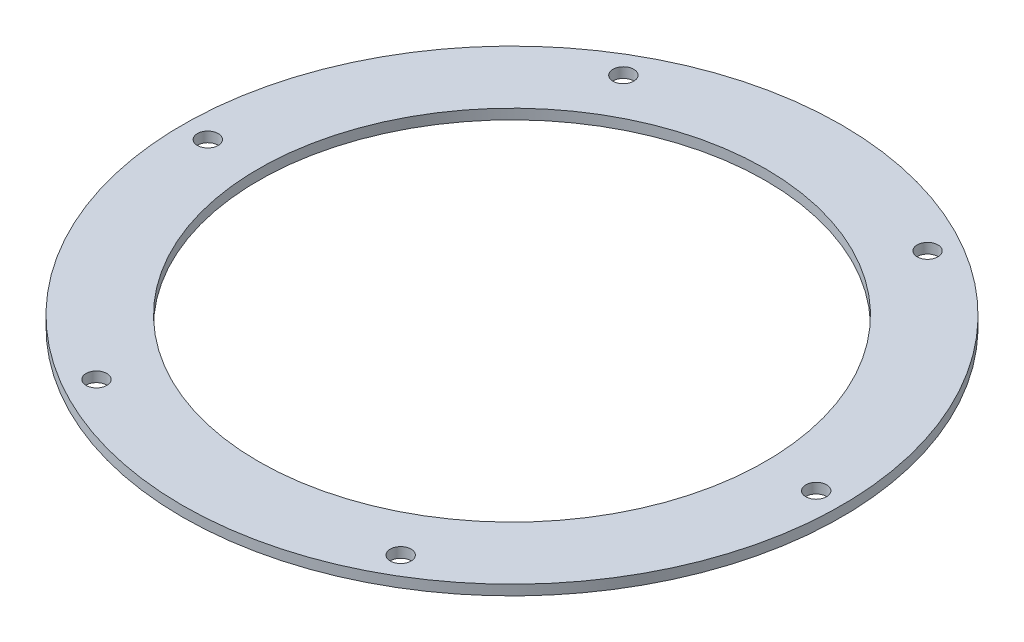
from build123d import *

# Parameters (mm, degrees)
SKETCH_1_R      = 65
SKETCH_1_R_2    = 50
SKETCH_1_R_3    = 2.05
EXTRUDE_1_DEPTH = 2


with BuildPart() as part:
    # 草图1 → 凸台-拉伸1 (new body)
    with BuildSketch(Plane(origin=(0, 0, 0), x_dir=(1, 0, 0), z_dir=(0, 1, 0))):
        with Locations(Location((0, 0, 0), (0, 0, 270))):
            Circle(SKETCH_1_R)
        with Locations(Location((0, 0, 0), (0, 0, 270))):
            Circle(SKETCH_1_R_2, mode=Mode.SUBTRACT)
        with Locations(Location((60, 0, 0), (0, 0, 270))):
            Circle(SKETCH_1_R_3, mode=Mode.SUBTRACT)
        with Locations(Location((30, -51.961524227, 0), (0, 0, 270))):
            Circle(SKETCH_1_R_3, mode=Mode.SUBTRACT)
        with Locations(Location((-30, -51.961524227, 0), (0, 0, 270))):
            Circle(SKETCH_1_R_3, mode=Mode.SUBTRACT)
        with Locations(Location((-60, 0, 0), (0, 0, 270))):
            Circle(SKETCH_1_R_3, mode=Mode.SUBTRACT)
        with Locations(Location((-30, 51.961524227, 0), (0, 0, 270))):
            Circle(SKETCH_1_R_3, mode=Mode.SUBTRACT)
        with Locations(Location((30, 51.961524227, 0), (0, 0, 270))):
            Circle(SKETCH_1_R_3, mode=Mode.SUBTRACT)
    extrude(amount=EXTRUDE_1_DEPTH)


solid = part.part
